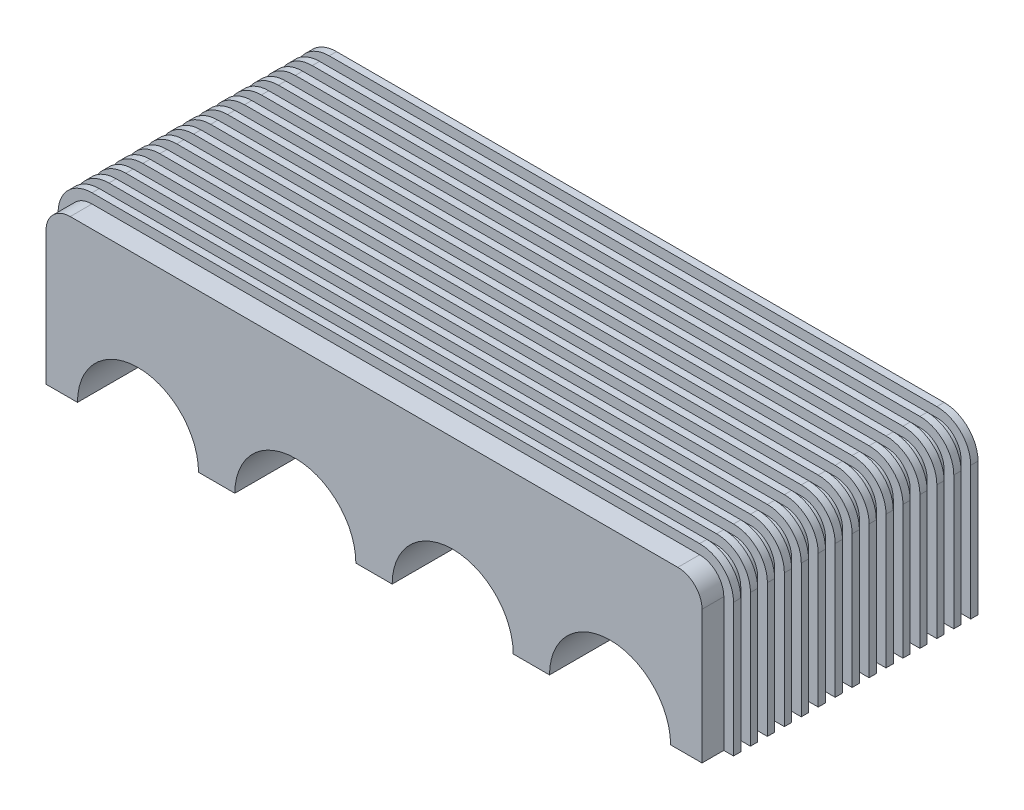
from build123d import *

# Parameters (mm, degrees)
BOSS_EXTRUDE1_DEPTH = 110
BOSS_EXTRUDE3_DEPTH = 3
LPATTERN1_COUNT     = 15
LPATTERN1_PITCH     = 7


with BuildPart() as part:
    # Sketch1 → Boss-Extrude1 (new body)
    with BuildSketch(Plane.XY):
        with BuildLine():
            Line((128, 0), (143, 0))
            ThreePointArc((143, 0), (168, 25), (193, 0))
            Line((193, 0), (208, 0))
            ThreePointArc((208, 0), (233, 25), (258, 0))
            Line((258, 0), (271, 0))
            Line((271, 0), (271, 55))
            ThreePointArc((271, 55), (268.071067812, 62.071067812), (261, 65))
            Line((261, 65), (10, 65))
            ThreePointArc((10, 65), (2.928932188, 62.071067812), (0, 55))
            Line((0, 55), (0, 0))
            Line((0, 0), (13, 0))
            ThreePointArc((13, 0), (38, 25), (63, 0))
            Line((63, 0), (78, 0))
            ThreePointArc((78, 0), (103, 25), (128, 0))
        make_face()
    extrude(amount=BOSS_EXTRUDE1_DEPTH)


with BuildPart() as body_2:
    # Sketch2 → Boss-Extrude3 (new body)
    with BuildSketch(Plane(origin=(0, 0, 0), x_dir=(-1, 0, 0), z_dir=(0, 0, -1))):
        with BuildLine():
            Line((4, 0), (4, 55))
            ThreePointArc((4, 55), (-0.100505063, 64.899494937), (-10, 69))
            Line((-10, 69), (-261, 69))
            ThreePointArc((-261, 69), (-270.899494937, 64.899494937), (-275, 55))
            Line((-275, 55), (-275, 0))
            Line((-275, 0), (-271, 0))
            Line((-271, 0), (-271, 55))
            ThreePointArc((-271, 55), (-268.071067812, 62.071067812), (-261, 65))
            Line((-261, 65), (-10, 65))
            ThreePointArc((-10, 65), (-2.928932188, 62.071067812), (0, 55))
            Line((0, 55), (0, 0))
            Line((0, 0), (4, 0))
        make_face()
    boss_extrude3 = extrude(amount=-BOSS_EXTRUDE3_DEPTH)


with BuildPart() as lpattern1_1:
    # LPattern1: Boss-Extrude3 ×15
    with Locations(*[(0, 0, i * LPATTERN1_PITCH) for i in range(1, LPATTERN1_COUNT)]):
        add(boss_extrude3)


solid = Compound([part.part, body_2.part, lpattern1_1.part])
